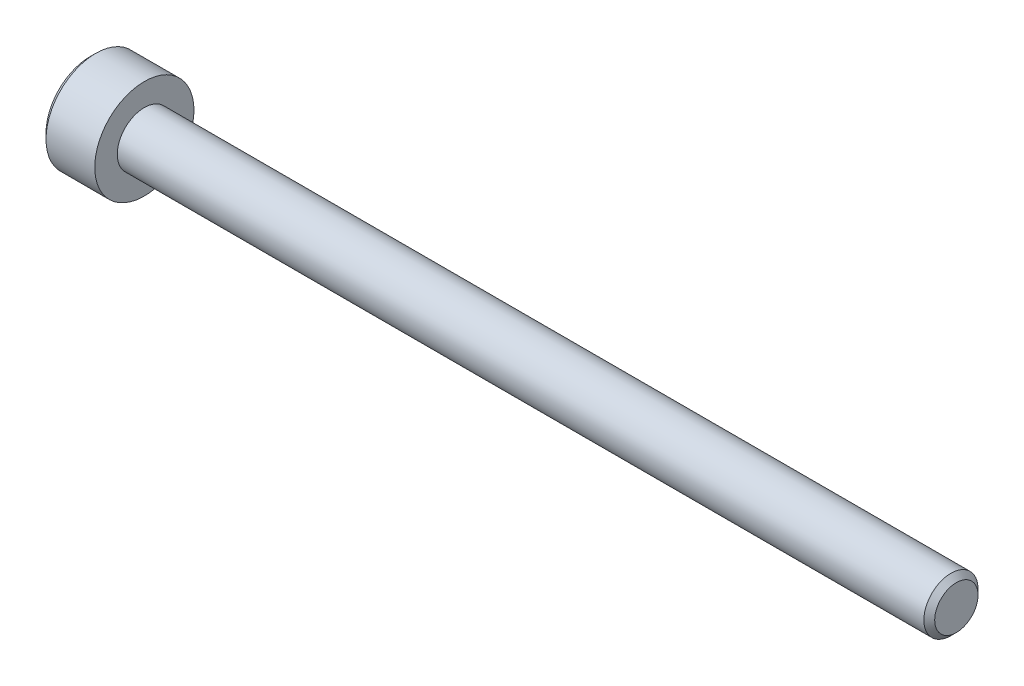
from build123d import *

# Parameters (mm, degrees)
SKETCH1_W           = 3
SKETCH1_H           = 2.75
SKETCH2_R           = 1.5
BOSS_EXTRUDE1_DEPTH = 45
CUT_EXTRUDE1_DEPTH  = 1.5
CHAMFER1_SIZE       = 0.3


with BuildPart() as part:
    # Sketch1 → Revolve1 (revolve)
    with BuildSketch(Plane.XY, mode=Mode.PRIVATE) as revolve1_sk:
        with Locations((-1.5, 1.375)):
            Rectangle(SKETCH1_W, SKETCH1_H)
    revolve(revolve1_sk.sketch.rotate(Axis((-3, 0, 0), (1, 0, 0)), 270), axis=Axis((-3, 0, 0), (1, 0, 0)))

    # Sketch2 → Boss-Extrude1 (add)
    with BuildSketch(Plane(origin=(0, 0, 0), x_dir=(0, 0, -1), z_dir=(1, 0, 0))):
        with Locations(Location((0, 0, 0), (0, 0, 180))):
            Circle(SKETCH2_R)
    extrude(amount=BOSS_EXTRUDE1_DEPTH)

    # Sketch3 → Cut-Extrude1 (cut)
    with BuildSketch(Plane.ZY.offset(3)):
        Polygon((1.25, -0.721687836), (1.25, 0.721687836), (0, 1.443375673), (-1.25, 0.721687836), (-1.25, -0.721687836), (0, -1.443375673), align=None)
    extrude(amount=-CUT_EXTRUDE1_DEPTH, mode=Mode.SUBTRACT)

    # Sketch4 → Cut-Revolve1 (revolve, cut)
    with BuildSketch(Plane.XY, mode=Mode.PRIVATE) as cut_revolve1_sk:
        Polygon((-1.5, 1.25), (-1.5, 0), (-1.165063509, 0), align=None)
    revolve(cut_revolve1_sk.sketch.rotate(Axis((-1.500025, 0, 0), (1, 0, 0)), 90), axis=Axis((-1.500025, 0, 0), (1, 0, 0)), mode=Mode.SUBTRACT)

    # Chamfer1
    chamfer1_edges = [part.edges().sort_by_distance(p)[0] for p in [
        (-3, 0, 2.75),
        (45, 0, -1.5),
    ]]
    chamfer(chamfer1_edges, length=CHAMFER1_SIZE)


solid = part.part
